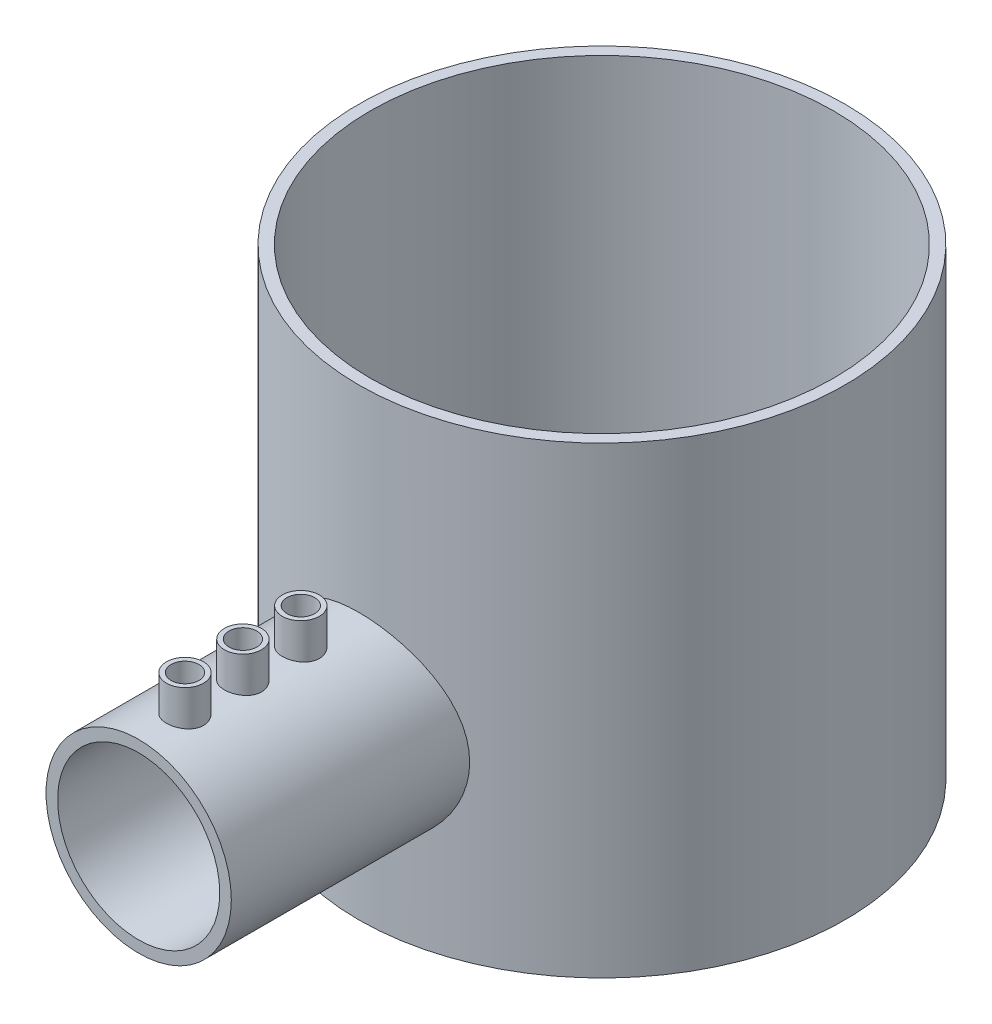
from build123d import *

# Parameters (mm, degrees)
SKETCH1_R                = 105
SKETCH1_R_2              = 100
BOSS_EXTRUDE1_DEPTH      = 200
BOSS_EXTRUDE2_REACH      = 451.098
BOSS_EXTRUDE2_END_RADIUS = 105
BOSS_EXTRUDE2_START      = 200
SKETCH2_R                = 40
SKETCH2_R_2              = 35
CUT_EXTRUDE1_REACH       = 303.703
SKETCH2_3_R              = 35
BOSS_EXTRUDE3_REACH      = 433.703
BOSS_EXTRUDE3_END_RADIUS = 40
BOSS_EXTRUDE3_START      = 130
SKETCH3_R                = 8
SKETCH3_R_2              = 6
BOSS_EXTRUDE4_REACH      = 423.703
BOSS_EXTRUDE4_END_RADIUS = 105
BOSS_EXTRUDE4_START      = -120
SKETCH2_5_R              = 8
SKETCH2_5_R_2            = 6


with BuildPart() as part:
    # Sketch1 → Boss-Extrude1 (new body)
    with BuildSketch(Plane(origin=(0, 0, 0), x_dir=(1, 0, 0), z_dir=(0, 1, 0))):
        Circle(SKETCH1_R)
        Circle(SKETCH1_R_2, mode=Mode.SUBTRACT)
    extrude(amount=BOSS_EXTRUDE1_DEPTH)

    # Boss-Extrude2: up to this cylinder (the profile starts outside it)
    boss_extrude2_end = Plane(origin=(0, 75, 0), z_dir=(0, -1, 0)) * Cylinder(BOSS_EXTRUDE2_END_RADIUS, 1113.196, mode=Mode.PRIVATE)
    # Sketch2 → Boss-Extrude2 (add, up to the surface)
    with BuildSketch(Plane.XY.offset(BOSS_EXTRUDE2_START), mode=Mode.PRIVATE) as boss_extrude2_sk1:
        with Locations((0, 75)):
            Circle(SKETCH2_R)
        with Locations((0, 75)):
            Circle(SKETCH2_R_2, mode=Mode.SUBTRACT)
    boss_extrude2_tool1 = extrude(boss_extrude2_sk1.sketch, amount=-BOSS_EXTRUDE2_REACH, mode=Mode.PRIVATE) - boss_extrude2_end
    add(boss_extrude2_tool1.solids().sort_by_distance((-38.868629, 75, 200))[0])

    # Sketch2<3> → Cut-Extrude1 (cut, up to next)
    with BuildSketch(Plane.XY, mode=Mode.PRIVATE) as cut_extrude1_sk1:
        with Locations((0, 75)):
            Circle(SKETCH2_3_R)
    cut_extrude1_tool1 = extrude(cut_extrude1_sk1.sketch, amount=CUT_EXTRUDE1_REACH, mode=Mode.PRIVATE) & part.part
    add(cut_extrude1_tool1.solids().sort_by_distance((0, 75, 0))[0], mode=Mode.SUBTRACT)

    # Boss-Extrude3: up to this cylinder (the profile starts outside it)
    boss_extrude3_end = Plane(origin=(0, 75, 155), z_dir=(0, 0, 1)) * Cylinder(BOSS_EXTRUDE3_END_RADIUS, 998.406, mode=Mode.PRIVATE)
    # Sketch3 → Boss-Extrude3 (add, up to the surface)
    with BuildSketch(Plane(origin=(0, 0, 0), x_dir=(1, 0, 0), z_dir=(0, 1, 0)).offset(BOSS_EXTRUDE3_START), mode=Mode.PRIVATE) as boss_extrude3_sk1:
        with Locations((0, -180)):
            Circle(SKETCH3_R)
        with Locations((0, -180)):
            Circle(SKETCH3_R_2, mode=Mode.SUBTRACT)
    boss_extrude3_tool1 = extrude(boss_extrude3_sk1.sketch, amount=-BOSS_EXTRUDE3_REACH, mode=Mode.PRIVATE) - boss_extrude3_end
    add(boss_extrude3_tool1.solids().sort_by_distance((-7.773726, 130, 180))[0])
    # Sketch3 → Boss-Extrude3 (add, up to the surface)
    with BuildSketch(Plane(origin=(0, 0, 0), x_dir=(1, 0, 0), z_dir=(0, 1, 0)).offset(BOSS_EXTRUDE3_START), mode=Mode.PRIVATE) as boss_extrude3_sk2:
        with Locations((0, -155)):
            Circle(SKETCH3_R)
        with Locations((0, -155)):
            Circle(SKETCH3_R_2, mode=Mode.SUBTRACT)
    boss_extrude3_tool2 = extrude(boss_extrude3_sk2.sketch, amount=-BOSS_EXTRUDE3_REACH, mode=Mode.PRIVATE) - boss_extrude3_end
    add(boss_extrude3_tool2.solids().sort_by_distance((-7.773726, 130, 155))[0])
    # Sketch3 → Boss-Extrude3 (add, up to the surface)
    with BuildSketch(Plane(origin=(0, 0, 0), x_dir=(1, 0, 0), z_dir=(0, 1, 0)).offset(BOSS_EXTRUDE3_START), mode=Mode.PRIVATE) as boss_extrude3_sk3:
        with Locations((0, -130)):
            Circle(SKETCH3_R)
        with Locations((0, -130)):
            Circle(SKETCH3_R_2, mode=Mode.SUBTRACT)
    boss_extrude3_tool3 = extrude(boss_extrude3_sk3.sketch, amount=-BOSS_EXTRUDE3_REACH, mode=Mode.PRIVATE) - boss_extrude3_end
    add(boss_extrude3_tool3.solids().sort_by_distance((-7.773726, 130, 130))[0])

    # Boss-Extrude4: up to this cylinder (the profile starts outside it)
    boss_extrude4_end = Plane(origin=(0, 75, 0), z_dir=(0, -1, 0)) * Cylinder(BOSS_EXTRUDE4_END_RADIUS, 1058.406, mode=Mode.PRIVATE)
    # Sketch2<5> → Boss-Extrude4 (add, up to the surface)
    with BuildSketch(Plane.XY.offset(BOSS_EXTRUDE4_START), mode=Mode.PRIVATE) as boss_extrude4_sk1:
        with Locations((0, 75)):
            Circle(SKETCH2_5_R)
        with Locations((0, 75)):
            Circle(SKETCH2_5_R_2, mode=Mode.SUBTRACT)
    boss_extrude4_tool1 = extrude(boss_extrude4_sk1.sketch, amount=BOSS_EXTRUDE4_REACH, mode=Mode.PRIVATE) - boss_extrude4_end
    add(boss_extrude4_tool1.solids().sort_by_distance((-7.773726, 75, -120))[0])


solid = part.part
